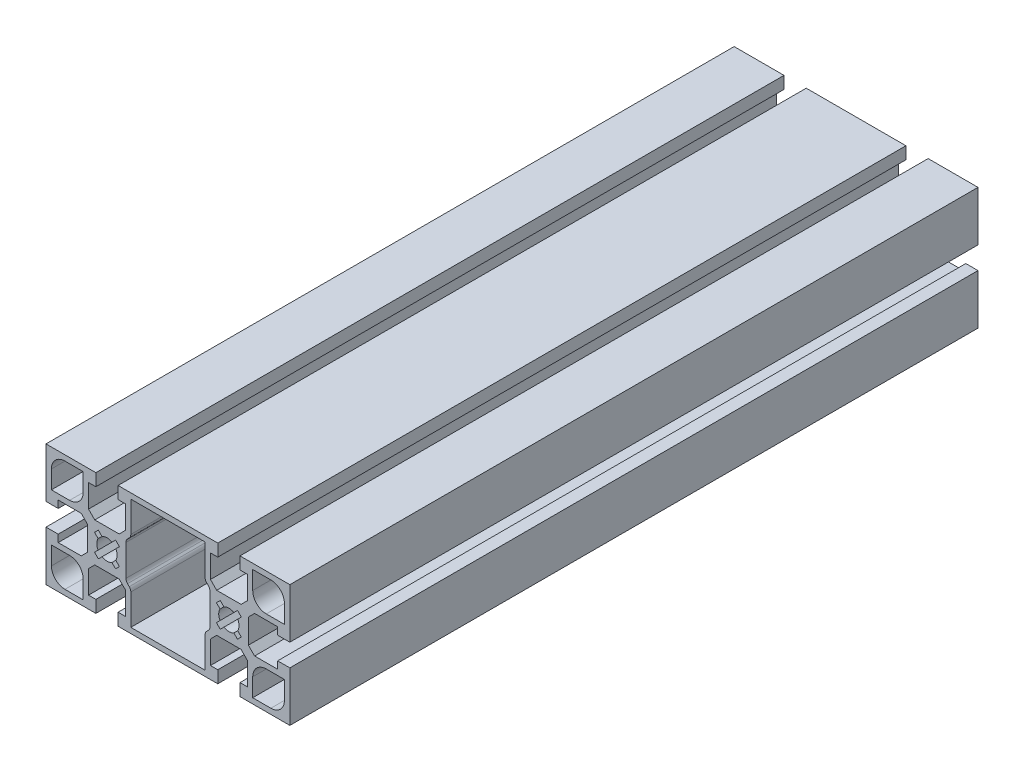
from build123d import *

# Parameters (mm, degrees)
BOSS_EXTRUDE1_DEPTH = 254


with BuildPart() as part:
    # Sketch1 → Boss-Extrude1 (new body)
    with BuildSketch(Plane(origin=(0, 0, 0), x_dir=(-1, 0, 0), z_dir=(0, 0, -1))):
        Polygon((-26.6, 22.5), (-45, 22.5), (-45, 4.1), (-40.5, 4.1), (-40.5, 6.8), (-32, 6.8), (-29.7, 4.5), (-29.7, -4.5), (-32, -6.8), (-40.5, -6.8), (-40.5, -4.1), (-45, -4.1), (-45, -22.5), (-26.6, -22.5), (-26.6, -18), (-29.3, -18), (-29.3, -9.5), (-27, -7.2), (-18, -7.2), (-15.7, -9.5), (-15.7, -18), (-18.4, -18), (-18.4, -22.5), (18.4, -22.5), (18.4, -18), (15.7, -18), (15.7, -9.5), (18, -7.2), (27, -7.2), (29.3, -9.5), (29.3, -18), (26.6, -18), (26.6, -22.5), (45, -22.5), (45, -4.1), (40.5, -4.1), (40.5, -6.8), (32, -6.8), (29.7, -4.5), (29.7, 4.5), (32, 6.8), (40.5, 6.8), (40.5, 4.1), (45, 4.1), (45, 22.5), (26.6, 22.5), (26.6, 18), (29.3, 18), (29.3, 9.5), (27, 7.2), (18, 7.2), (15.7, 9.5), (15.7, 18), (18.4, 18), (18.4, 22.5), (-18.4, 22.5), (-18.4, 18), (-15.7, 18), (-15.7, 9.5), (-18, 7.2), (-27, 7.2), (-29.3, 9.5), (-29.3, 18), (-26.6, 18), align=None)
        with BuildLine():
            Line((14.914213713, -7.157382523), (14.285798144, -7.785798093))
            ThreePointArc((14.285798144, -7.785798093), (13.852252641, -8.434644791), (13.700011706, -9.200011655))
            Line((13.700011706, -9.200011655), (13.700011706, -20.5))
            Line((13.700011706, -20.5), (-13.700011706, -20.5))
            Line((-13.700011706, -20.5), (-13.700011706, -9.200011568))
            ThreePointArc((-13.700011706, -9.200011568), (-13.852252624, -8.434644744), (-14.285798082, -7.785798067))
            Line((-14.285798082, -7.785798067), (-14.914213624, -7.15738247))
            ThreePointArc((-14.914213624, -7.15738247), (-15.347759082, -6.508535794), (-15.5, -5.74316897))
            Line((-15.5, -5.74316897), (-15.5, 5.7431692))
            ThreePointArc((-15.5, 5.7431692), (-15.347759065, 6.508536064), (-14.914213562, 7.157382762))
            Line((-14.914213562, 7.157382762), (-14.285798144, 7.78579818))
            ThreePointArc((-14.285798144, 7.78579818), (-13.852252641, 8.434644878), (-13.700011706, 9.200011743))
            Line((-13.700011706, 9.200011743), (-13.700011706, 20.5))
            Line((-13.700011706, 20.5), (13.700011706, 20.5))
            Line((13.700011706, 20.5), (13.700011706, 9.200011728))
            ThreePointArc((13.700011706, 9.200011728), (13.852252624, 8.434644904), (14.285798082, 7.785798227))
            Line((14.285798082, 7.785798227), (14.914213775, 7.157382479))
            ThreePointArc((14.914213775, 7.157382479), (15.347759233, 6.508535803), (15.500000151, 5.743168979))
            Line((15.500000151, 5.743168979), (15.500000151, -5.743168961))
            ThreePointArc((15.500000151, -5.743168961), (15.347759216, -6.508535826), (14.914213713, -7.157382523))
        make_face(mode=Mode.SUBTRACT)
        with BuildLine():
            Line((43, 15.5), (43, 8.799988823))
            Line((43, 8.799988823), (36.300017792, 8.799988823))
            ThreePointArc((36.300017792, 8.799988823), (32.764483886, 10.264454917), (31.300017792, 13.799988823))
            Line((31.300017792, 13.799988823), (31.300017792, 20.5))
            Line((31.300017792, 20.5), (38, 20.5))
            ThreePointArc((38, 20.5), (41.535533906, 19.035533906), (43, 15.5))
        make_face(mode=Mode.SUBTRACT)
        with BuildLine():
            Line((-36.300017792, 8.799988823), (-43, 8.799988823))
            Line((-43, 8.799988823), (-43, 15.5))
            ThreePointArc((-43, 15.5), (-41.535533906, 19.035533906), (-38, 20.5))
            Line((-38, 20.5), (-31.300017792, 20.5))
            Line((-31.300017792, 20.5), (-31.300017792, 13.799988823))
            ThreePointArc((-31.300017792, 13.799988823), (-32.764483886, 10.264454917), (-36.300017792, 8.799988823))
        make_face(mode=Mode.SUBTRACT)
        with BuildLine():
            Line((-43, -15.5), (-43, -8.7999878))
            Line((-43, -8.7999878), (-36.300017792, -8.7999878))
            ThreePointArc((-36.300017792, -8.7999878), (-32.764483886, -10.264453894), (-31.300017792, -13.7999878))
            Line((-31.300017792, -13.7999878), (-31.300017792, -20.5))
            Line((-31.300017792, -20.5), (-38, -20.5))
            ThreePointArc((-38, -20.5), (-41.535533906, -19.035533906), (-43, -15.5))
        make_face(mode=Mode.SUBTRACT)
        with BuildLine():
            Line((36.300017792, -8.7999878), (43, -8.7999878))
            Line((43, -8.7999878), (43, -15.5))
            ThreePointArc((43, -15.5), (41.535533906, -19.035533906), (38, -20.5))
            Line((38, -20.5), (31.300017792, -20.5))
            Line((31.300017792, -20.5), (31.300017792, -13.7999878))
            ThreePointArc((31.300017792, -13.7999878), (32.764483886, -10.264453894), (36.300017792, -8.7999878))
        make_face(mode=Mode.SUBTRACT)
        with BuildLine():
            Line((-20.651475745, 3.262737818), (-19.318019484, 4.59619408))
            Line((-19.318019484, 4.59619408), (-17.903805921, 3.181980517))
            Line((-17.903805921, 3.181980517), (-19.237262182, 1.848524255))
            ThreePointArc((-19.237262182, 1.848524255), (-18.750000002, 0), (-19.237262183, -1.848524255))
            Line((-19.237262183, -1.848524255), (-17.903805921, -3.181980517))
            Line((-17.903805921, -3.181980517), (-19.318019483, -4.596194079))
            Line((-19.318019483, -4.596194079), (-20.651475745, -3.262737818))
            ThreePointArc((-20.651475745, -3.262737818), (-22.5, -3.749999998), (-24.348524255, -3.262737818))
            Line((-24.348524255, -3.262737818), (-25.681980515, -4.596194078))
            Line((-25.681980515, -4.596194078), (-27.096194078, -3.181980516))
            Line((-27.096194078, -3.181980516), (-25.762737818, -1.848524255))
            ThreePointArc((-25.762737818, -1.848524255), (-26.249999999, 0), (-25.762737818, 1.848524255))
            Line((-25.762737818, 1.848524255), (-27.096194079, 3.181980517))
            Line((-27.096194079, 3.181980517), (-25.681980517, 4.596194079))
            Line((-25.681980517, 4.596194079), (-24.348524255, 3.262737818))
            ThreePointArc((-24.348524255, 3.262737818), (-22.5, 3.749999999), (-20.651475745, 3.262737818))
        make_face(mode=Mode.SUBTRACT)
        with BuildLine():
            Line((27.096194079, 3.181980516), (25.762737818, 1.848524255))
            ThreePointArc((25.762737818, 1.848524255), (26.249999999, 0), (25.762737818, -1.848524255))
            Line((25.762737818, -1.848524255), (27.09619408, -3.181980517))
            Line((27.09619408, -3.181980517), (25.681980518, -4.596194079))
            Line((25.681980518, -4.596194079), (24.348524256, -3.262737818))
            ThreePointArc((24.348524256, -3.262737818), (22.500000001, -3.749999999), (20.651475745, -3.262737818))
            Line((20.651475745, -3.262737818), (19.318019485, -4.596194078))
            Line((19.318019485, -4.596194078), (17.903805922, -3.181980515))
            Line((17.903805922, -3.181980515), (19.237262182, -1.848524255))
            ThreePointArc((19.237262182, -1.848524255), (18.750000002, 0), (19.237262182, 1.848524255))
            Line((19.237262182, 1.848524255), (17.903805921, 3.181980516))
            Line((17.903805921, 3.181980516), (19.318019483, 4.596194079))
            Line((19.318019483, 4.596194079), (20.651475745, 3.262737817))
            ThreePointArc((20.651475745, 3.262737817), (22.5, 3.749999998), (24.348524255, 3.262737818))
            Line((24.348524255, 3.262737818), (25.681980517, 4.596194079))
            Line((25.681980517, 4.596194079), (27.096194079, 3.181980516))
        make_face(mode=Mode.SUBTRACT)
    extrude(amount=-BOSS_EXTRUDE1_DEPTH)


solid = part.part
